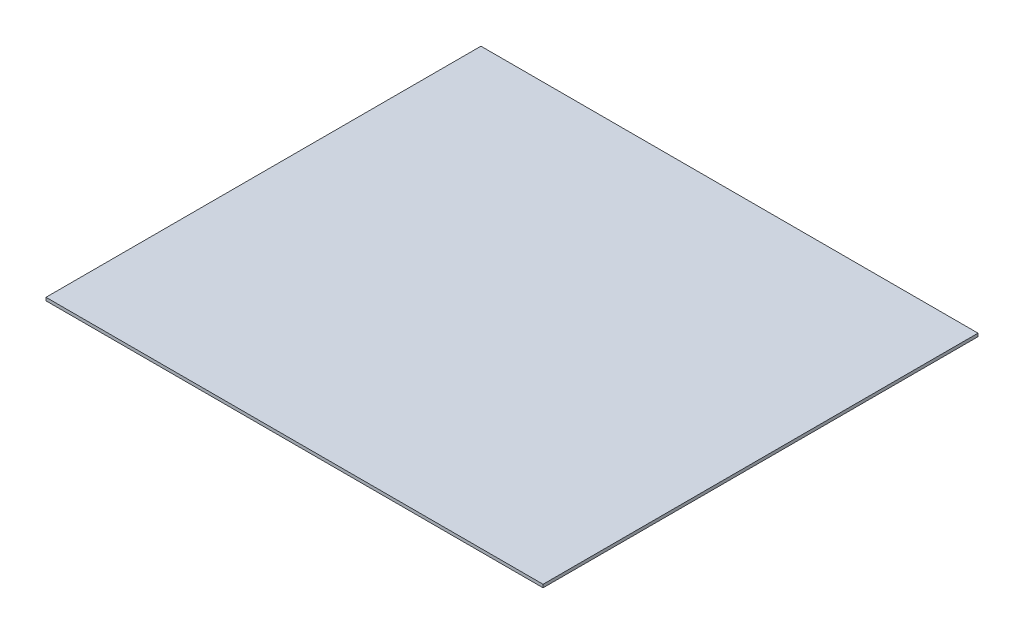
from build123d import *

# Parameters (mm, degrees)
SKETCH_1_W      = 800
SKETCH_1_H      = 700
EXTRUDE_1_DEPTH = 5


with BuildPart() as part:
    # 草图1 → 凸台-拉伸1 (new body)
    with BuildSketch(Plane(origin=(0, 0, 0), x_dir=(1, 0, 0), z_dir=(0, 1, 0))):
        with Locations((-400, 350)):
            Rectangle(SKETCH_1_W, SKETCH_1_H)
    extrude(amount=EXTRUDE_1_DEPTH)


solid = part.part
